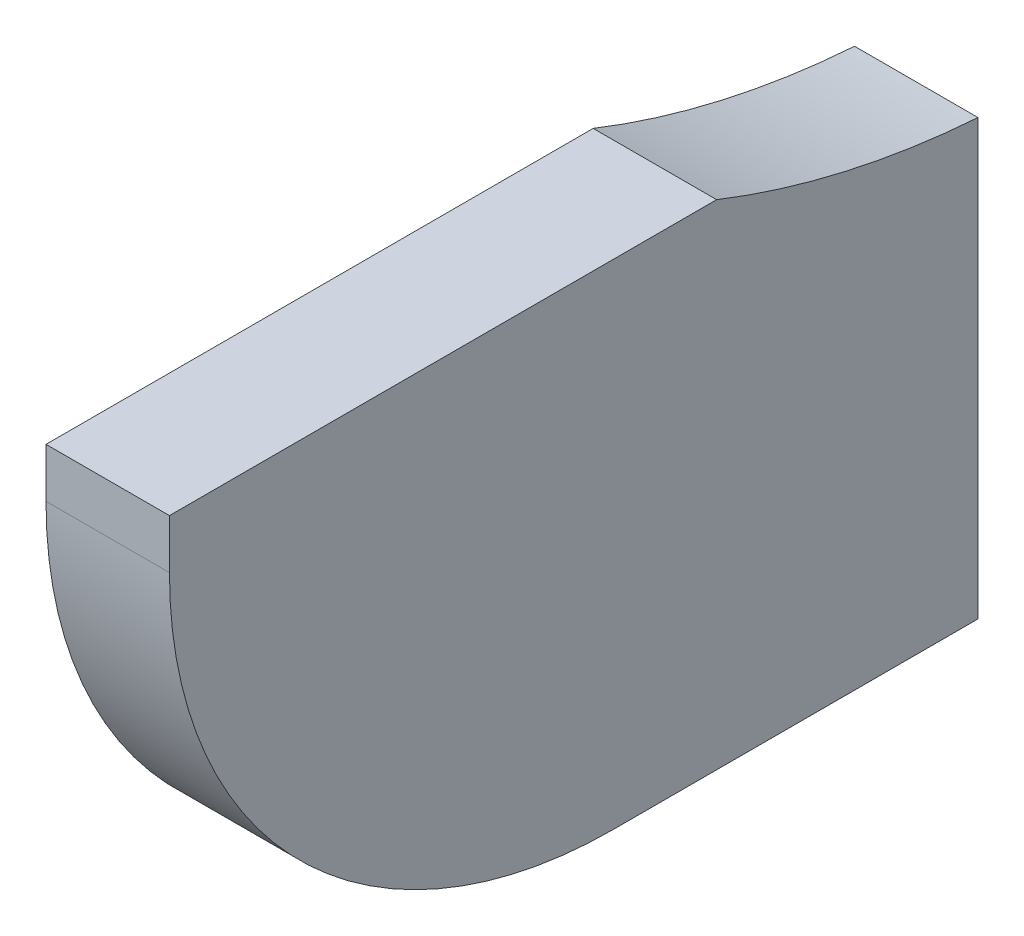
from build123d import *

# Parameters (mm, degrees)
SKETCH1_W               = 5
SKETCH1_H               = 20
BOSS_EXTRUDE1_DEPTH     = 84.5
CUT_EXTRUDE2_DEPTH      = 35
CUT_EXTRUDE2_DEPTH_BACK = 35
SKETCH5_R               = 35.5
SKETCH2_W               = 5
SKETCH2_H               = 20
CUT_EXTRUDE3_DEPTH      = 13
SKETCH8_W               = 39.75
SKETCH8_H               = 20
CUT_EXTRUDE4_DEPTH      = 13
SKETCH9_W               = 5
SKETCH9_H               = 7
CUT_EXTRUDE5_DEPTH      = 24
FILLET1_R               = 18


with BuildPart() as part:
    # Sketch1 → Boss-Extrude1 (new body)
    with BuildSketch(Plane.XY):
        with Locations((-2.5, 10)):
            Rectangle(SKETCH1_W, SKETCH1_H)
    extrude(amount=BOSS_EXTRUDE1_DEPTH)

    # Sketch5 → Cut-Extrude2 (cut, two sides: drawn at the far end of the back side and taken through both)
    with BuildSketch(Plane(origin=(0, 0, 0), x_dir=(0, 0, -1), z_dir=(1, 0, 0)).offset(-CUT_EXTRUDE2_DEPTH_BACK)):
        with Locations((-42.25, 53)):
            Circle(SKETCH5_R)
    extrude(amount=CUT_EXTRUDE2_DEPTH + CUT_EXTRUDE2_DEPTH_BACK, mode=Mode.SUBTRACT)

    # Sketch2 → Cut-Extrude3 (cut)
    with BuildSketch(Plane.ZY.offset(5)):
        with Locations((42.25, 10)):
            Rectangle(SKETCH2_W, SKETCH2_H)
    extrude(amount=-CUT_EXTRUDE3_DEPTH, mode=Mode.SUBTRACT)


with BuildPart() as cut_extrude3_piece_1:
    # of the separate pieces the step leaves, piece 1, a body of its own (cut_extrude3_pieces)
    add(part.part.solids().sort_by_distance((0, 0, 44.75))[0])

    # Sketch9 → Cut-Extrude5 (cut)
    with BuildSketch(Plane(origin=(0, 20, 0), x_dir=(1, 0, 0), z_dir=(0, 1, 0))):
        with Locations((-2.5, -81)):
            Rectangle(SKETCH9_W, SKETCH9_H)
    extrude(amount=-CUT_EXTRUDE5_DEPTH, mode=Mode.SUBTRACT)

    # Fillet1
    fillet1_edges = [cut_extrude3_piece_1.edges().sort_by_distance(p)[0] for p in [
        (-2.5, 0, 77.5),
    ]]
    fillet(fillet1_edges, radius=FILLET1_R)


with BuildPart() as cut_extrude3_piece_2:
    # of the separate pieces the step leaves, piece 2, a body of its own (cut_extrude3_pieces)
    add(part.part.solids().sort_by_distance((-5, 20, 0))[0])

    # Sketch8 → Cut-Extrude4 (cut)
    with BuildSketch(Plane.ZY.offset(5)):
        with Locations((19.875, 10)):
            Rectangle(SKETCH8_W, SKETCH8_H)
    extrude(amount=-CUT_EXTRUDE4_DEPTH, mode=Mode.SUBTRACT)


solid = cut_extrude3_piece_1.part
